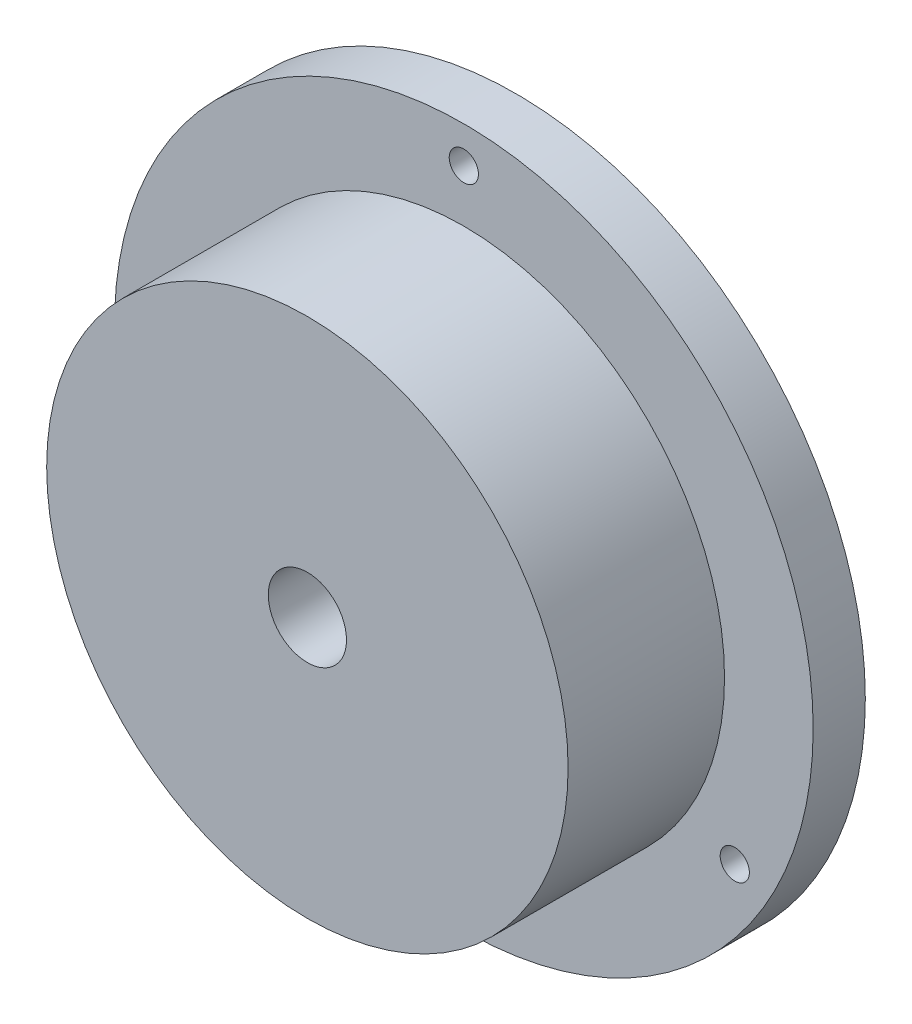
from build123d import *

# Parameters (mm, degrees)
SKETCH1_R                      = 21.2725
BOSS_EXTRUDE1_DEPTH            = 3.175
SKETCH2_R                      = 15.875
BOSS_EXTRUDE2_DEPTH            = 9.525
F_3_16_0_1875_DIAMETER_HOLE1_D = 4.7625
F_2_56_TAPPED_HOLE3_D          = 1.778
CIRPATTERN1_COUNT              = 3
F_8_32_TAPPED_HOLE1_D          = 3.4544
F_8_32_TAPPED_HOLE1_DEPTH      = 21.2715
F_8_32_TAPPED_HOLE1_TIP        = 1.037806461
SKETCH14_R                     = 7.9375
CUT_EXTRUDE1_DEPTH             = 3.8862


with BuildPart() as part:
    # Sketch1 → Boss-Extrude1 (new body)
    with BuildSketch(Plane.XY):
        Circle(SKETCH1_R)
    extrude(amount=BOSS_EXTRUDE1_DEPTH)

    # Sketch2 → Boss-Extrude2 (add)
    with BuildSketch(Plane.XY.offset(3.175)):
        with Locations(Location((0, 0, 0), (0, 0, 180))):
            Circle(SKETCH2_R)
    extrude(amount=BOSS_EXTRUDE2_DEPTH)

    # 3/16 (0.1875) Diameter Hole1 (through all)
    with Locations(Plane.XY.offset(12.7)):
        with Locations((0, 0)):
            Hole(F_3_16_0_1875_DIAMETER_HOLE1_D / 2)

    # #2-56 Tapped Hole3 (through all)
    with Locations(Plane.XY.offset(3.175)):
        with Locations((0, 19.05)):
            f_2_56_tapped_hole3 = Hole(F_2_56_TAPPED_HOLE3_D / 2)

    # CirPattern1: #2-56 Tapped Hole3 ×3 about axis
    cirpattern1_axis = Axis((0, 0, 0), (0, 0, 1))
    for i in range(1, CIRPATTERN1_COUNT):
        add(f_2_56_tapped_hole3.rotate(cirpattern1_axis, i * 360 / CIRPATTERN1_COUNT), mode=Mode.SUBTRACT)

    # #8-32 Tapped Hole1
    with Locations(Plane.XZ.offset(21.2725)):
        with Locations((0, 7.9248)):
            Hole(F_8_32_TAPPED_HOLE1_D / 2, depth=F_8_32_TAPPED_HOLE1_DEPTH)
            with Locations((0, 0, -(F_8_32_TAPPED_HOLE1_DEPTH + F_8_32_TAPPED_HOLE1_TIP / 2))):  # 118° drill point
                Cone(0, F_8_32_TAPPED_HOLE1_D / 2, F_8_32_TAPPED_HOLE1_TIP, mode=Mode.SUBTRACT)

    # Sketch14 → Cut-Extrude1 (cut)
    with BuildSketch(Plane(origin=(0, 0, 0), x_dir=(-1, 0, 0), z_dir=(0, 0, -1))):
        Circle(SKETCH14_R)
    extrude(amount=-CUT_EXTRUDE1_DEPTH, mode=Mode.SUBTRACT)


solid = part.part
